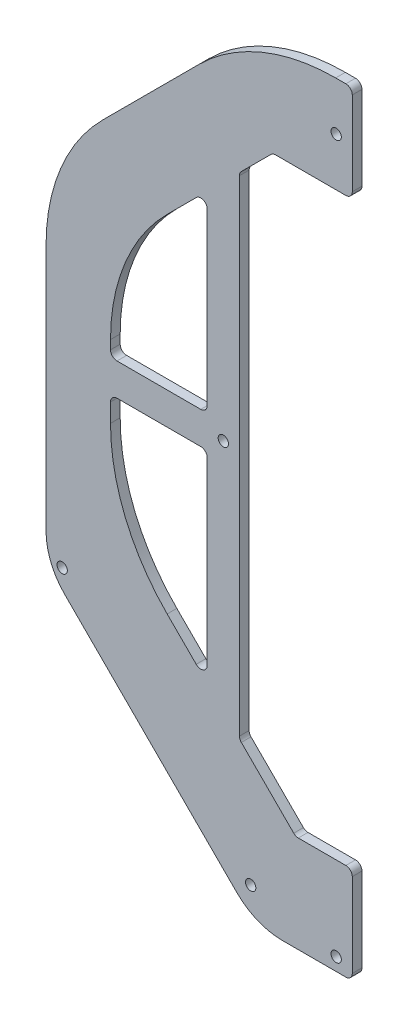
from build123d import *

# Parameters (mm, degrees)
SKETCH_1_R      = 1.6
EXTRUDE_1_DEPTH = 3
FILLET_1_R      = 60
FILLET_2_R      = 2
FILLET_3_R      = 20
FILLET_4_R      = 2


with BuildPart() as part:
    # ｽｹｯﾁ1 → ﾎﾞｽ - 押し出し1 (new body)
    with BuildSketch(Plane.XY):
        Polygon((-30, 0), (0, 0), (0, 30), (-17.573593129, 30), (-35, 47.426406871), (-35, 199.644660941), (-24.644660941, 210), (0, 210), (0, 240), (-30, 240), (-95, 175), (-95, 65), align=None)
        Polygon((-75, 159.644660941), (-45, 189.644660941), (-45, 130.035533906), (-75, 130.035533906), align=None, mode=Mode.SUBTRACT)
        Polygon((-45, 120.035533906), (-45, 57.426406871), (-75, 87.426406871), (-75, 120.035533906), align=None, mode=Mode.SUBTRACT)
        with Locations((-90, 66)):
            Circle(SKETCH_1_R, mode=Mode.SUBTRACT)
        with Locations((-31.514718626, 10)):
            Circle(SKETCH_1_R, mode=Mode.SUBTRACT)
        with Locations((-5, 4)):
            Circle(SKETCH_1_R, mode=Mode.SUBTRACT)
        with Locations((-5, 225)):
            Circle(SKETCH_1_R, mode=Mode.SUBTRACT)
        with Locations((-40, 125.035533906)):
            Circle(SKETCH_1_R, mode=Mode.SUBTRACT)
    extrude(amount=EXTRUDE_1_DEPTH)

    # ﾌｨﾚｯﾄ1
    fillet_1_edges = [part.edges().sort_by_distance(p)[0] for p in [
        (-75, 159.644660941, 1.5),
        (-95, 175, 1.5),
        (-30, 240, 1.5),
        (-75, 87.426406871, 1.5),
    ]]
    fillet(fillet_1_edges, radius=FILLET_1_R)

    # ﾌｨﾚｯﾄ2
    fillet_2_edges = [part.edges().sort_by_distance(p)[0] for p in [
        (-17.573593129, 30, 1.5),
        (0, 30, 1.5),
        (0, 0, 1.5),
        (0, 240, 1.5),
        (0, 210, 1.5),
        (-24.644660941, 210, 1.5),
        (-35, 199.644660941, 1.5),
        (-35, 47.426406871, 1.5),
    ]]
    fillet(fillet_2_edges, radius=FILLET_2_R)

    # ﾌｨﾚｯﾄ3
    fillet_3_edges = [part.edges().sort_by_distance(p)[0] for p in [
        (-30, 0, 1.5),
        (-95, 65, 1.5),
    ]]
    fillet(fillet_3_edges, radius=FILLET_3_R)

    # ﾌｨﾚｯﾄ4
    fillet_4_edges = [part.edges().sort_by_distance(p)[0] for p in [
        (-45, 189.644660941, 1.5),
        (-75, 130.035533906, 1.5),
        (-45, 130.035533906, 1.5),
        (-75, 120.035533906, 1.5),
        (-45, 57.426406871, 1.5),
        (-45, 120.035533906, 1.5),
    ]]
    fillet(fillet_4_edges, radius=FILLET_4_R)


solid = part.part
